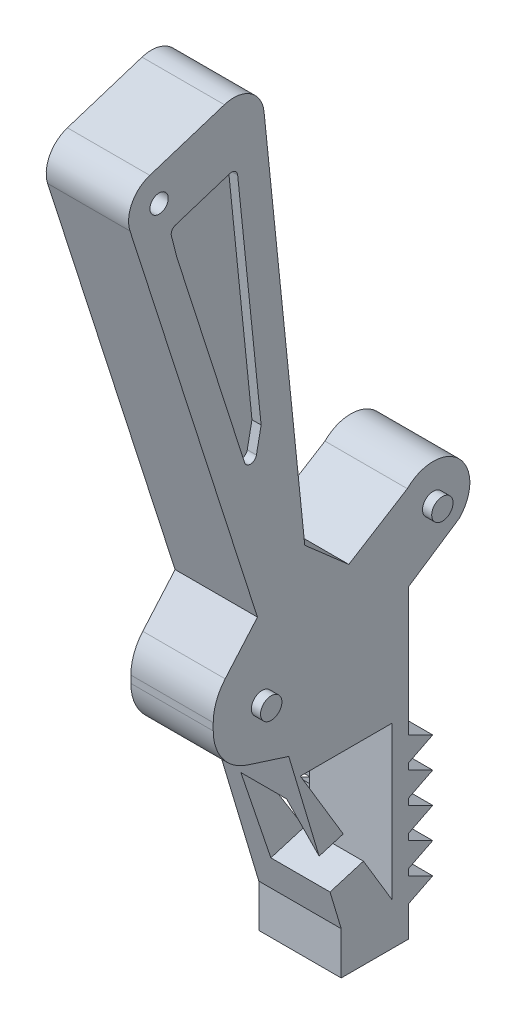
from build123d import *

# Parameters (mm, degrees)
BOSS_EXTRUDE2_DEPTH = 6.75
CUT_EXTRUDE1_DEPTH  = 102.982599985
BOSS_EXTRUDE3_DEPTH = 18
LPATTERN1_COUNT     = 5
LPATTERN1_PITCH     = 5
FILLET1_R           = 8
FILLET2_R           = 5
SKETCH6_R           = 1.5
CUT_EXTRUDE2_DEPTH  = 102.325844179
CUT_EXTRUDE4_DEPTH  = 8
SKETCH9_R           = 1.75
BOSS_EXTRUDE4_DEPTH = 1.5
SKETCH10_R          = 1.75
BOSS_EXTRUDE5_DEPTH = 1.5
CUT_EXTRUDE6_START  = -1.5
CUT_EXTRUDE6_DEPTH  = 103.825844179


with BuildPart() as part:
    # Sketch2 → Boss-Extrude2 (new, symmetric)
    with BuildSketch(Plane(origin=(0, 0, 0), x_dir=(0, 0, -1), z_dir=(1, 0, 0))):
        with BuildLine():
            Line((-2.079082888, 77.410237912), (20.329453697, 7.410237912))
            Line((20.329453697, 7.410237912), (13.081464201, -0.95554047))
            Line((13.081464201, -0.95554047), (13.081464201, -10.95554047))
            Line((13.081464201, -10.95554047), (25.46023991, -14.926171648))
            Line((25.46023991, -14.926171648), (34.052646544, -43.669354287))
            Line((34.052646544, -43.669354287), (34.052646544, -50.669354287))
            Line((34.052646544, -50.669354287), (45.052646544, -50.669354287))
            Line((45.052646544, -50.669354287), (45.052646544, -0.669354287))
            Line((45.052646544, -0.669354287), (51.414117074, 3.570151924))
            Line((51.414117074, 3.570151924), (53.374039372, 4.876312617))
            ThreePointArc((53.374039372, 4.876312617), (53.374039372, 13.361593991), (44.888757997, 13.361593991))
            Line((44.888757997, 13.361593991), (35.302946487, 7.410237912))
            Line((35.302946487, 7.410237912), (28.081464201, 13.727383878))
            Line((28.081464201, 13.727383878), (20.778287365, 84.727383878))
            Line((20.778287365, 84.727383878), (-2.079082888, 77.410237912))
        make_face()
    extrude(amount=BOSS_EXTRUDE2_DEPTH, both=True)

    # Sketch4 → Cut-Extrude1 (cut, through all)
    with BuildSketch(Plane(origin=(6.75, 0, 0), x_dir=(0, 0, -1), z_dir=(1, 0, 0))):
        Polygon((42.352646544, -43.669354287), (42.352646544, -18.669354287), (27.352646544, -18.669354287), align=None)
    extrude(amount=-CUT_EXTRUDE1_DEPTH, mode=Mode.SUBTRACT)

    # Sketch5 → Boss-Extrude3 (add)
    with BuildSketch(Plane(origin=(6.75, 0, 0), x_dir=(0, 0, -1), z_dir=(1, 0, 0))):
        Polygon((49.052646544, -43.669354287), (45.052646544, -41.669354287), (45.052646544, -43.669354287), align=None)
        Polygon((49.052646544, -43.669354287), (45.052646544, -43.669354287), (45.052646544, -45.669354287), align=None)
    boss_extrude3 = extrude(amount=-BOSS_EXTRUDE3_DEPTH)

    # LPattern1: Boss-Extrude3 ×5
    with Locations(*[(0, i * LPATTERN1_PITCH, 0) for i in range(1, LPATTERN1_COUNT)]):
        add(boss_extrude3)

    # Fillet1
    fillet1_edges = [part.edges().sort_by_distance(p)[0] for p in [
        (0, -10.95554047, -13.081464201),
        (0, -0.95554047, -13.081464201),
    ]]
    fillet(fillet1_edges, radius=FILLET1_R)

    # Fillet2
    fillet2_edges = [part.edges().sort_by_distance(p)[0] for p in [
        (0, 77.410237912, 2.079082888),
        (0, 84.727383878, -20.778287365),
    ]]
    fillet(fillet2_edges, radius=FILLET2_R)

    # Sketch6 → Cut-Extrude2 (cut, through all)
    with BuildSketch(Plane(origin=(6.75, 0, 0), x_dir=(0, 0, -1), z_dir=(1, 0, 0))):
        with Locations((4.207274657, 74.172691185)):
            Circle(SKETCH6_R)
    extrude(amount=-CUT_EXTRUDE2_DEPTH, mode=Mode.SUBTRACT)

    # Sketch8 → Cut-Extrude4 (cut)
    with BuildSketch(Plane(origin=(0, 5.762226271, -19.275708093), x_dir=(1, 0, 0), z_dir=(0, -0.28641355449068423, 0.9581060879693918))):
        Polygon((-3.75, -30.834539791), (3.75, -30.834539791), (9.054771206, -45.201974161), (-2.945228794, -45.201974161), align=None)
    extrude(amount=-CUT_EXTRUDE4_DEPTH, mode=Mode.SUBTRACT)

    # Sketch9 → Boss-Extrude4 (add)
    with BuildSketch(Plane(origin=(6.75, 0, 0), x_dir=(0, 0, -1), z_dir=(1, 0, 0))):
        with Locations((49.131398685, 9.118953304)):
            Circle(SKETCH9_R)
    boss_extrude4 = extrude(amount=BOSS_EXTRUDE4_DEPTH)

    # Sketch10 → Boss-Extrude5 (add)
    with BuildSketch(Plane(origin=(6.75, 0, 0), x_dir=(0, 0, -1), z_dir=(1, 0, 0))):
        with Locations((21.081464201, -5.120153169)):
            Circle(SKETCH10_R)
    boss_extrude5 = extrude(amount=BOSS_EXTRUDE5_DEPTH)

    # Sketch11 → Cut-Extrude6 (cut)
    with BuildSketch(Plane(origin=(6.75, 0, 0), x_dir=(0, 0, -1), z_dir=(1, 0, 0)).offset(CUT_EXTRUDE6_START)):
        with BuildLine():
            Line((15.78419602, 72.628770071), (6.886860744, 69.780537742))
            ThreePointArc((6.886860744, 69.780537742), (6.316756639, 69.312297005), (6.22287904, 68.580549047))
            Line((6.22287904, 68.580549047), (7.115164558, 65.08899702))
            Line((7.115164558, 65.08899702), (18.222367047, 30.392212101))
            ThreePointArc((18.222367047, 30.392212101), (19.230775138, 29.698663405), (20.155274557, 30.50065935))
            Line((20.155274557, 30.50065935), (20.931307176, 34.374295724))
            Line((20.931307176, 34.374295724), (17.083828456, 71.778701405))
            ThreePointArc((17.083828456, 71.778701405), (16.636465842, 72.51325811), (15.78419602, 72.628770071))
        make_face()
    cut_extrude6 = extrude(amount=CUT_EXTRUDE6_DEPTH, mode=Mode.SUBTRACT)

    # Mirror1: Boss-Extrude4, Boss-Extrude5, Cut-Extrude6 across plane
    add(boss_extrude4.mirror(Plane(origin=(0, 0, 0), x_dir=(0, 0, 1), z_dir=(1, 0, 0))))
    add(boss_extrude5.mirror(Plane(origin=(0, 0, 0), x_dir=(0, 0, 1), z_dir=(1, 0, 0))))
    add(cut_extrude6.mirror(Plane(origin=(0, 0, 0), x_dir=(0, 0, 1), z_dir=(1, 0, 0))), mode=Mode.SUBTRACT)


solid = part.part
